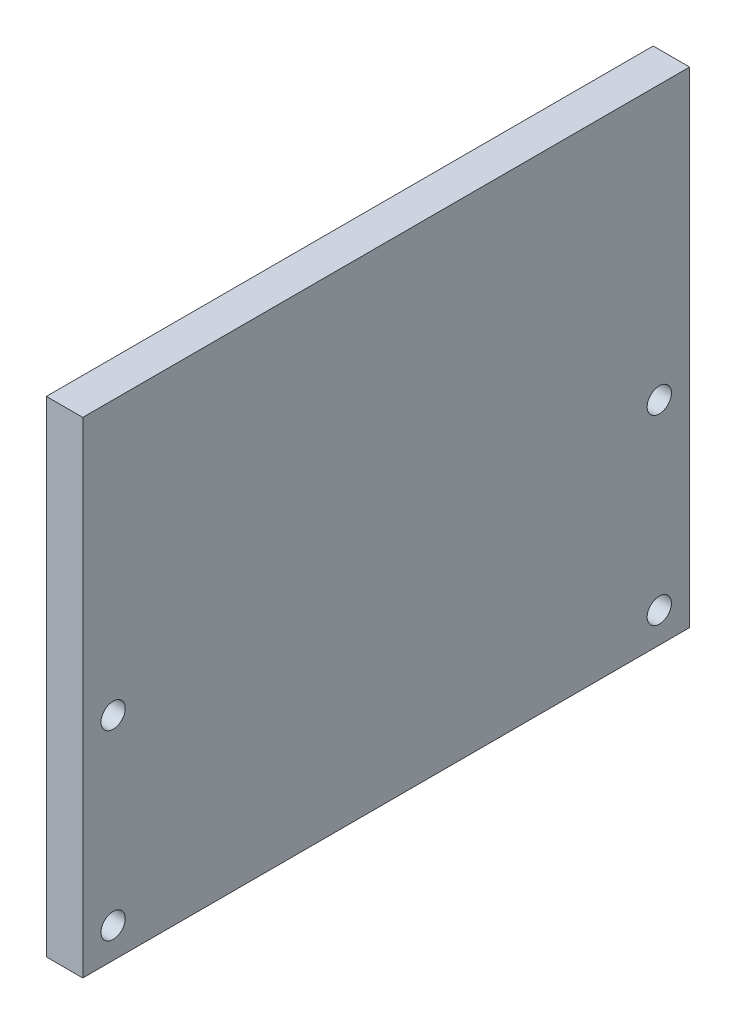
from build123d import *

# Parameters (mm, degrees)
CROQUIS1_R              = 1
SALIENTE_EXTRUIR3_DEPTH = 3


with BuildPart() as part:
    # Croquis1 → Saliente-Extruir3 (new body)
    with BuildSketch(Plane(origin=(0, 0, 0), x_dir=(0, 0, -1), z_dir=(1, 0, 0))):
        Polygon((-25.961538462, 0), (-25.961538462, 20), (-0.961538462, 20), (24.038461538, 20), (24.038461538, 0), (24.038461538, -20), (-25.961538462, -20), align=None)
        with Locations((-23.461538462, -17.5)):
            Circle(CROQUIS1_R, mode=Mode.SUBTRACT)
        with Locations(Location((21.538461538, -17.5, 0), (0, 0, 180))):
            Circle(CROQUIS1_R, mode=Mode.SUBTRACT)
        with Locations((21.538461538, -2.5)):
            Circle(CROQUIS1_R, mode=Mode.SUBTRACT)
        with Locations(Location((-23.461538462, -2.5, 0), (0, 0, 180))):
            Circle(CROQUIS1_R, mode=Mode.SUBTRACT)
    extrude(amount=SALIENTE_EXTRUIR3_DEPTH)


solid = part.part
